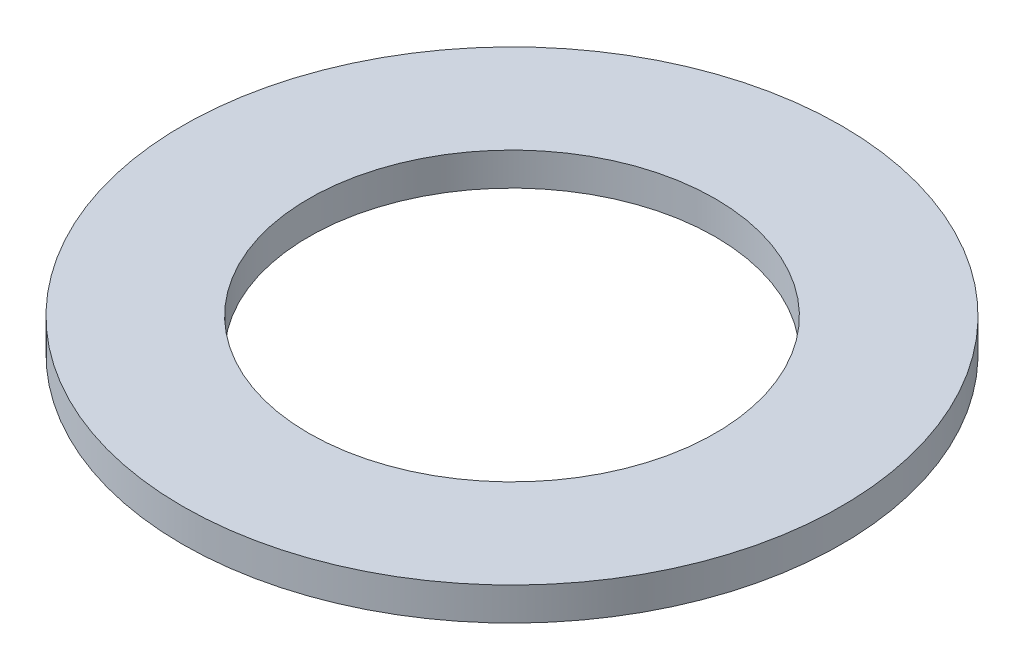
from build123d import *

# Parameters (mm, degrees)
SKETCH1_R           = 15
SKETCH1_R_2         = 9.25
BOSS_EXTRUDE1_DEPTH = 0.75


with BuildPart() as part:
    # Sketch1 → Boss-Extrude1 (new, symmetric)
    with BuildSketch(Plane(origin=(0, 0, 0), x_dir=(1, 0, 0), z_dir=(0, 1, 0))):
        with Locations(Location((0, 0, 0), (0, 0, 270))):
            Circle(SKETCH1_R)
        with Locations(Location((0, 0, 0), (0, 0, 270))):
            Circle(SKETCH1_R_2, mode=Mode.SUBTRACT)
    extrude(amount=BOSS_EXTRUDE1_DEPTH, both=True)


solid = part.part
